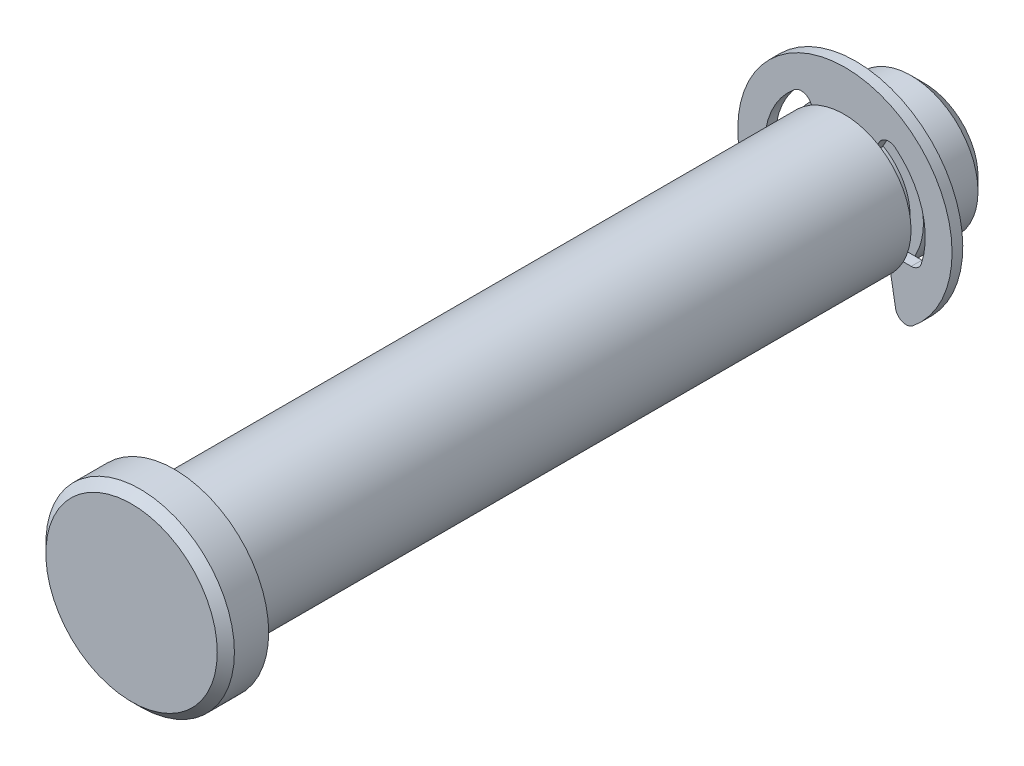
from build123d import *

# Parameters (mm, degrees)
SKETCH2_R      = 3.96875
EXTRUDE1_DEPTH = 22.225
SKETCH3_W      = 0.7366
SKETCH3_H      = 0.79375
SKETCH8_R      = 5.588
EXTRUDE6_DEPTH = 2.54
CHAMFER2_SIZE  = 0.508
SKETCH4_R      = 6.35
SKETCH4_R_2    = 3.175
EXTRUDE2_DEPTH = 0.3175
EXTRUDE4_DEPTH = 27.342935011
EXTRUDE5_DEPTH = 0.635
FILLET1_R      = 0.635
CHAMFER1_SIZE  = 0.79375


with BuildPart() as part:
    # Sketch2 → Extrude1 (new, symmetric)
    with BuildSketch(Plane.XY):
        Circle(SKETCH2_R)
    extrude(amount=EXTRUDE1_DEPTH, both=True)

    # Sketch3 → Cut-Revolve1 (revolve, cut)
    with BuildSketch(Plane(origin=(0, 0, 0), x_dir=(0, 0, -1), z_dir=(1, 0, 0)), mode=Mode.PRIVATE) as cut_revolve1_sk:
        with Locations((17.8308, 3.571875)):
            Rectangle(SKETCH3_W, SKETCH3_H)
    revolve(cut_revolve1_sk.sketch.rotate(Axis((0, 0, 22.225), (0, 0, -1)), 90), axis=Axis((0, 0, 22.225), (0, 0, -1)), mode=Mode.SUBTRACT)

    # Sketch8 → Extrude6 (add)
    with BuildSketch(Plane.XY.offset(22.225)):
        Circle(SKETCH8_R)
    extrude(amount=EXTRUDE6_DEPTH)

    # Chamfer2
    chamfer2_edges = [part.edges().sort_by_distance(p)[0] for p in [
        (-5.588, 0, 24.765),
    ]]
    chamfer(chamfer2_edges, length=CHAMFER2_SIZE)

    # Chamfer1
    chamfer1_edges = [part.edges().sort_by_distance(p)[0] for p in [
        (-3.96875, 0, -22.225),
    ]]
    chamfer(chamfer1_edges, length=CHAMFER1_SIZE)


with BuildPart() as body_2:
    # Sketch4 → Extrude2 (new, symmetric)
    with BuildSketch(Plane.XY.offset(-17.8308)):
        Circle(SKETCH4_R)
        Circle(SKETCH4_R_2, mode=Mode.SUBTRACT)
    extrude(amount=EXTRUDE2_DEPTH, both=True)

    # Sketch5 → Extrude4 (cut, through all)
    with BuildSketch(Plane.XY):
        with BuildLine():
            Line((-2.38125, 4.124445986), (0, 0))
            Line((0, 0), (2.38125, 4.124445986))
            ThreePointArc((2.38125, 4.124445986), (4.523958552, 1.488356568), (4.364903349, -1.905))
            Line((4.364903349, -1.905), (2.54, -1.905))
            Line((2.54, -1.905), (3.173879308, -5.499908194))
            ThreePointArc((3.173879308, -5.499908194), (0, -6.35), (-3.173879308, -5.499908194))
            Line((-3.173879308, -5.499908194), (-2.54, -1.905))
            Line((-2.54, -1.905), (-4.364903349, -1.905))
            ThreePointArc((-4.364903349, -1.905), (-4.523958552, 1.488356568), (-2.38125, 4.124445986))
        make_face()
    extrude(amount=-EXTRUDE4_DEPTH, mode=Mode.SUBTRACT)

    # Sketch6 → Extrude5 (add)
    with BuildSketch(Plane.XY.offset(-17.5133)):
        with BuildLine():
            Line((-1.5875, 2.749630657), (1.5875, 2.749630657))
            ThreePointArc((1.5875, 2.749630657), (0, 3.175), (-1.5875, 2.749630657))
        make_face()
    extrude(amount=-EXTRUDE5_DEPTH)

    # Fillet1
    fillet1_edges = [body_2.edges().sort_by_distance(p)[0] for p in [
        (2.38125, 4.124445986, -17.8308),
        (3.173879308, -5.499908194, -17.8308),
        (-4.364903349, -1.905, -17.8308),
        (4.364903349, -1.905, -17.8308),
        (-3.173879308, -5.499908194, -17.8308),
        (-2.38125, 4.124445986, -17.8308),
    ]]
    fillet(fillet1_edges, radius=FILLET1_R)


solid = Compound([part.part, body_2.part])
